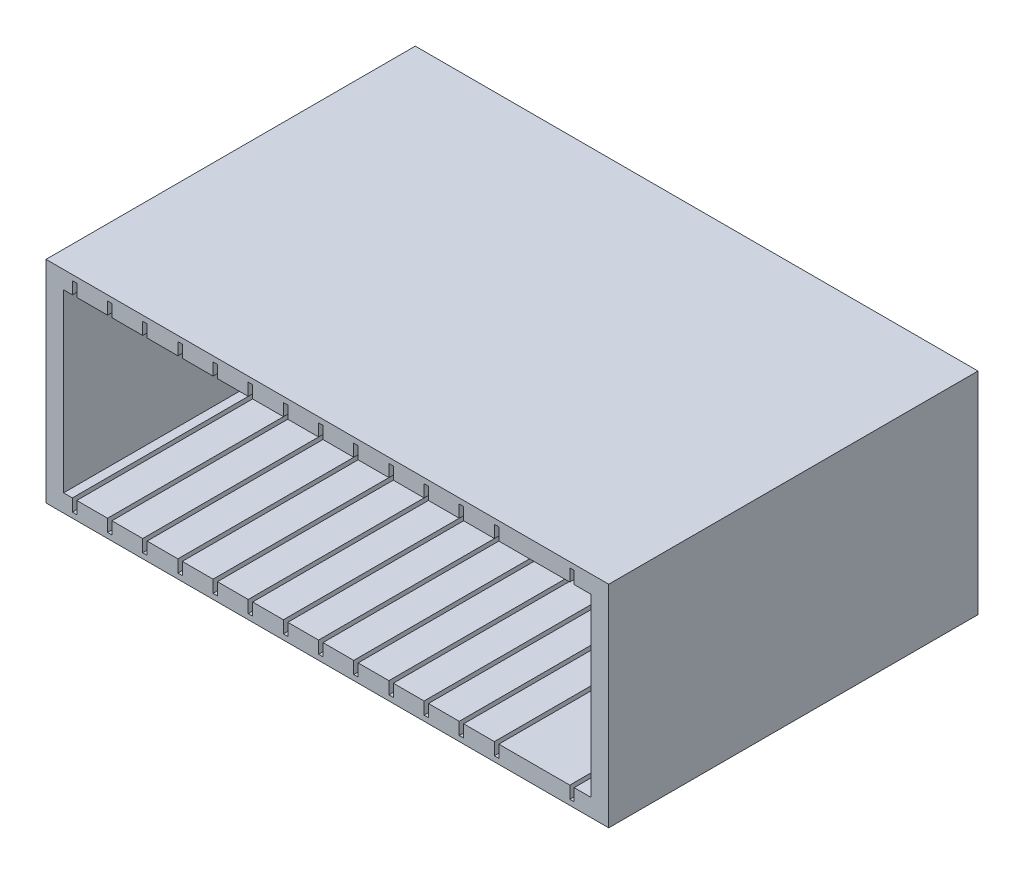
from build123d import *

# Parameters (mm, degrees)
SKETCH1_W           = 203.2
SKETCH1_H           = 76.2
BOSS_EXTRUDE1_DEPTH = 133.35
SHELL1_T            = -6.35
SKETCH2_W           = 1.5875
SKETCH2_H           = 72.39
CUT_EXTRUDE1_DEPTH  = 127
LPATTERN1_COUNT     = 13
LPATTERN1_PITCH     = 12.7
CUT_EXTRUDE2_START  = -127
SKETCH3_W           = 1.5875
SKETCH3_H           = 72.39
CUT_EXTRUDE2_DEPTH  = 127


with BuildPart() as part:
    # Sketch1 → Boss-Extrude1 (new body)
    with BuildSketch(Plane.XY):
        Rectangle(SKETCH1_W, SKETCH1_H)
    extrude(amount=BOSS_EXTRUDE1_DEPTH)

    # Shell1
    shell1_openings = [part.faces().sort_by_distance(p)[0] for p in [
        (0, 0, 133.35),
    ]]
    offset(amount=SHELL1_T, openings=shell1_openings, kind=Kind.INTERSECTION)

    # Sketch2 → Cut-Extrude1 (cut)
    with BuildSketch(Plane.XY.offset(133.35)):
        with Locations((-91.28125, 0)):
            Rectangle(SKETCH2_W, SKETCH2_H)
    cut_extrude1 = extrude(amount=-CUT_EXTRUDE1_DEPTH, mode=Mode.SUBTRACT)

    # LPattern1: Cut-Extrude1 ×13
    with Locations(*[(i * LPATTERN1_PITCH, 0, 0) for i in range(1, LPATTERN1_COUNT)]):
        add(cut_extrude1, mode=Mode.SUBTRACT)

    # Sketch3 → Cut-Extrude2 (cut)
    with BuildSketch(Plane.XY.offset(133.35).offset(CUT_EXTRUDE2_START)):
        with Locations((88.33739, 0)):
            Rectangle(SKETCH3_W, SKETCH3_H)
    extrude(amount=CUT_EXTRUDE2_DEPTH, mode=Mode.SUBTRACT)


solid = part.part
